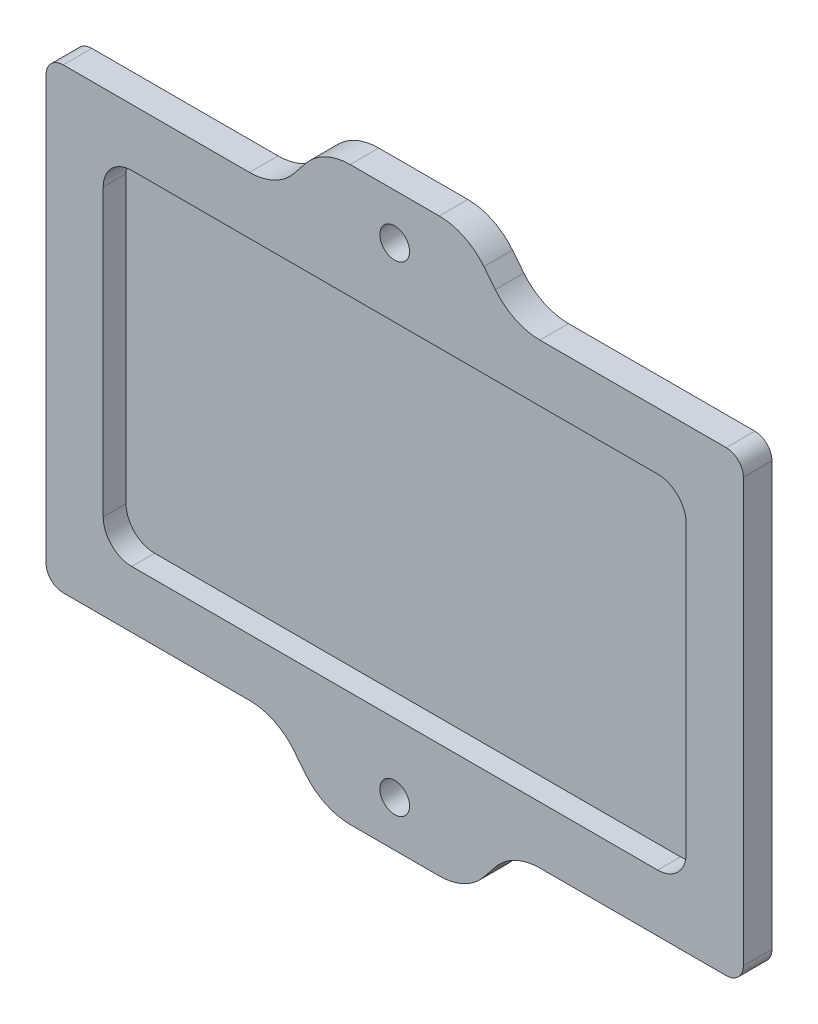
from build123d import *

# Parameters (mm, degrees)
BOSS_EXTRUDE1_DEPTH = 5
CUT_EXTRUDE1_START  = -10
SKETCH3_R           = 2.6
CUT_EXTRUDE1_DEPTH  = 10
FILLET1_R           = 10
FILLET2_R           = 3
SKETCH4_R           = 2.6
CUT_EXTRUDE2_DEPTH  = 10
CUT_EXTRUDE3_DEPTH  = 4
CUT_EXTRUDE4_DEPTH  = 10


with BuildPart() as part:
    # Sketch1 → Boss-Extrude1 (new body)
    with BuildSketch(Plane.XY):
        with BuildLine():
            Line((-42.619167718, 65.881324086), (73.380832282, 65.881324086))
            ThreePointArc((73.380832282, 65.881324086), (75.502152626, 65.002644429), (76.380832282, 62.881324086))
            Line((76.380832282, 62.881324086), (76.380832282, -41.118675914))
            ThreePointArc((76.380832282, -41.118675914), (75.502152626, -43.239996258), (73.380832282, -44.118675914))
            Line((73.380832282, -44.118675914), (-42.619167718, -44.118675914))
            ThreePointArc((-42.619167718, -44.118675914), (-44.740488061, -43.239996258), (-45.619167718, -41.118675914))
            Line((-45.619167718, -41.118675914), (-45.619167718, 62.881324086))
            ThreePointArc((-45.619167718, 62.881324086), (-44.740488061, 65.002644429), (-42.619167718, 65.881324086))
        make_face()
    extrude(amount=BOSS_EXTRUDE1_DEPTH)

    # Sketch3 → Cut-Extrude1 (cut)
    with BuildSketch(Plane.XY.offset(5).offset(CUT_EXTRUDE1_START)):
        with BuildLine():
            Line((-42.619167718, 65.881324086), (6.780832282, 65.881324086))
            Line((6.780832282, 65.881324086), (6.780832282, 81.136513461))
            Line((6.780832282, 81.136513461), (-45.619167718, 81.136513461))
            Line((-45.619167718, 81.136513461), (-45.619167718, 62.881324086))
            ThreePointArc((-45.619167718, 62.881324086), (-44.740488061, 65.002644429), (-42.619167718, 65.881324086))
        make_face()
        with BuildLine():
            Line((-2.217047099, 54.63427273), (6.780832282, 65.881324086))
            Line((6.780832282, 65.881324086), (-42.619167718, 65.881324086))
            ThreePointArc((-42.619167718, 65.881324086), (-44.740488061, 65.002644429), (-45.619167718, 62.881324086))
            Line((-45.619167718, 62.881324086), (-45.619167718, 50.881324086))
            Line((-45.619167718, 50.881324086), (-10.025654488, 50.881324086))
            ThreePointArc((-10.025654488, 50.881324086), (-5.693825403, 51.868263741), (-2.217047099, 54.63427273))
        make_face()
        with BuildLine():
            ThreePointArc((73.380832282, 65.881324086), (75.502152626, 65.002644429), (76.380832282, 62.881324086))
            Line((76.380832282, 62.881324086), (76.380832282, 81.136513461))
            Line((76.380832282, 81.136513461), (23.980832282, 81.136513461))
            Line((23.980832282, 81.136513461), (23.980832282, 65.881324086))
            Line((23.980832282, 65.881324086), (73.380832282, 65.881324086))
        make_face()
        with BuildLine():
            ThreePointArc((32.978711664, 54.63427273), (36.455489968, 51.868263741), (40.787319053, 50.881324086))
            Line((40.787319053, 50.881324086), (76.380832282, 50.881324086))
            Line((76.380832282, 50.881324086), (76.380832282, 62.881324086))
            ThreePointArc((76.380832282, 62.881324086), (75.502152626, 65.002644429), (73.380832282, 65.881324086))
            Line((73.380832282, 65.881324086), (23.980832282, 65.881324086))
            Line((23.980832282, 65.881324086), (32.978711664, 54.63427273))
        make_face()
        with BuildLine():
            Line((76.380832282, -41.118675914), (76.380832282, -29.118675914))
            Line((76.380832282, -29.118675914), (40.787319053, -29.118675914))
            ThreePointArc((40.787319053, -29.118675914), (36.455489968, -30.105615569), (32.978711664, -32.871624558))
            Line((32.978711664, -32.871624558), (23.980832282, -44.118675914))
            Line((23.980832282, -44.118675914), (73.380832282, -44.118675914))
            ThreePointArc((73.380832282, -44.118675914), (75.502152626, -43.239996258), (76.380832282, -41.118675914))
        make_face()
        with BuildLine():
            Line((76.380832282, -59.373865289), (76.380832282, -41.118675914))
            ThreePointArc((76.380832282, -41.118675914), (75.502152626, -43.239996258), (73.380832282, -44.118675914))
            Line((73.380832282, -44.118675914), (23.980832282, -44.118675914))
            Line((23.980832282, -44.118675914), (23.980832282, -59.373865289))
            Line((23.980832282, -59.373865289), (76.380832282, -59.373865289))
        make_face()
        with BuildLine():
            Line((-42.619167718, -44.118675914), (6.780832282, -44.118675914))
            Line((6.780832282, -44.118675914), (-2.217047099, -32.871624558))
            ThreePointArc((-2.217047099, -32.871624558), (-5.693825403, -30.105615569), (-10.025654488, -29.118675914))
            Line((-10.025654488, -29.118675914), (-45.619167718, -29.118675914))
            Line((-45.619167718, -29.118675914), (-45.619167718, -41.118675914))
            ThreePointArc((-45.619167718, -41.118675914), (-44.740488061, -43.239996258), (-42.619167718, -44.118675914))
        make_face()
        with BuildLine():
            Line((6.780832282, -59.373865289), (6.780832282, -44.118675914))
            Line((6.780832282, -44.118675914), (-42.619167718, -44.118675914))
            ThreePointArc((-42.619167718, -44.118675914), (-44.740488061, -43.239996258), (-45.619167718, -41.118675914))
            Line((-45.619167718, -41.118675914), (-45.619167718, -59.373865289))
            Line((-45.619167718, -59.373865289), (6.780832282, -59.373865289))
        make_face()
        with Locations((15.380832282, -31.118675914)):
            Circle(SKETCH3_R)
    extrude(amount=CUT_EXTRUDE1_DEPTH, mode=Mode.SUBTRACT)

    # Fillet1
    fillet1_edges = [part.edges().sort_by_distance(p)[0] for p in [
        (6.780832282, 65.881324086, 2.5),
        (23.980832282, 65.881324086, 2.5),
        (23.980832282, -44.118675914, 2.5),
        (6.780832282, -44.118675914, 2.5),
    ]]
    fillet(fillet1_edges, radius=FILLET1_R)

    # Fillet2
    fillet2_edges = [part.edges().sort_by_distance(p)[0] for p in [
        (-45.619167718, -29.118675914, 2.5),
        (-45.619167718, 50.881324086, 2.5),
        (76.380832282, 50.881324086, 2.5),
        (76.380832282, -29.118675914, 2.5),
    ]]
    fillet(fillet2_edges, radius=FILLET2_R)

    # Sketch4 → Cut-Extrude2 (cut)
    with BuildSketch(Plane.XY.offset(5)):
        with Locations((15.380832282, 52.881324086)):
            Circle(SKETCH4_R)
    extrude(amount=-CUT_EXTRUDE2_DEPTH, mode=Mode.SUBTRACT)

    # Sketch5 → Cut-Extrude3 (cut)
    with BuildSketch(Plane.XY.offset(5)):
        with BuildLine():
            Line((-30.619167718, 40.881324086), (61.380832282, 40.881324086))
            ThreePointArc((61.380832282, 40.881324086), (64.916366188, 39.416857992), (66.380832282, 35.881324086))
            Line((66.380832282, 35.881324086), (66.380832282, -14.118675914))
            ThreePointArc((66.380832282, -14.118675914), (64.916366188, -17.65420982), (61.380832282, -19.118675914))
            Line((61.380832282, -19.118675914), (-30.619167718, -19.118675914))
            ThreePointArc((-30.619167718, -19.118675914), (-34.154701623, -17.65420982), (-35.619167718, -14.118675914))
            Line((-35.619167718, -14.118675914), (-35.619167718, 35.881324086))
            ThreePointArc((-35.619167718, 35.881324086), (-34.154701623, 39.416857992), (-30.619167718, 40.881324086))
        make_face()
    extrude(amount=-CUT_EXTRUDE3_DEPTH, mode=Mode.SUBTRACT)

    # Sketch6 → Cut-Extrude4 (cut)
    with BuildSketch(Plane.XY.offset(5)):
        with BuildLine():
            Line((23.165898511, 60.881324086), (7.595766054, 60.881324086))
            ThreePointArc((7.595766054, 60.881324086), (3.25131348, 59.888306479), (-0.230315515, 57.106470452))
            Line((-0.230315515, 57.106470452), (-2.058004159, 58.560279644))
            Line((-2.058004159, 58.560279644), (6.679710473, 70.400464375))
            Line((6.679710473, 70.400464375), (28.478804217, 70.400464375))
            Line((28.478804217, 70.400464375), (32.819668724, 58.560279644))
            Line((32.819668724, 58.560279644), (30.99198008, 57.106470452))
            ThreePointArc((30.99198008, 57.106470452), (27.510351085, 59.888306479), (23.165898511, 60.881324086))
        make_face()
        with BuildLine():
            Line((28.478804217, -48.637816204), (32.819668724, -36.797631473))
            Line((32.819668724, -36.797631473), (30.99198008, -35.343822281))
            ThreePointArc((30.99198008, -35.343822281), (27.510351085, -38.125658307), (23.165898511, -39.118675914))
            Line((23.165898511, -39.118675914), (7.595766054, -39.118675914))
            ThreePointArc((7.595766054, -39.118675914), (3.25131348, -38.125658307), (-0.230315515, -35.343822281))
            Line((-0.230315515, -35.343822281), (-2.058004159, -36.797631473))
            Line((-2.058004159, -36.797631473), (6.679710473, -48.637816204))
            Line((6.679710473, -48.637816204), (28.478804217, -48.637816204))
        make_face()
    extrude(amount=-CUT_EXTRUDE4_DEPTH, mode=Mode.SUBTRACT)


solid = part.part
